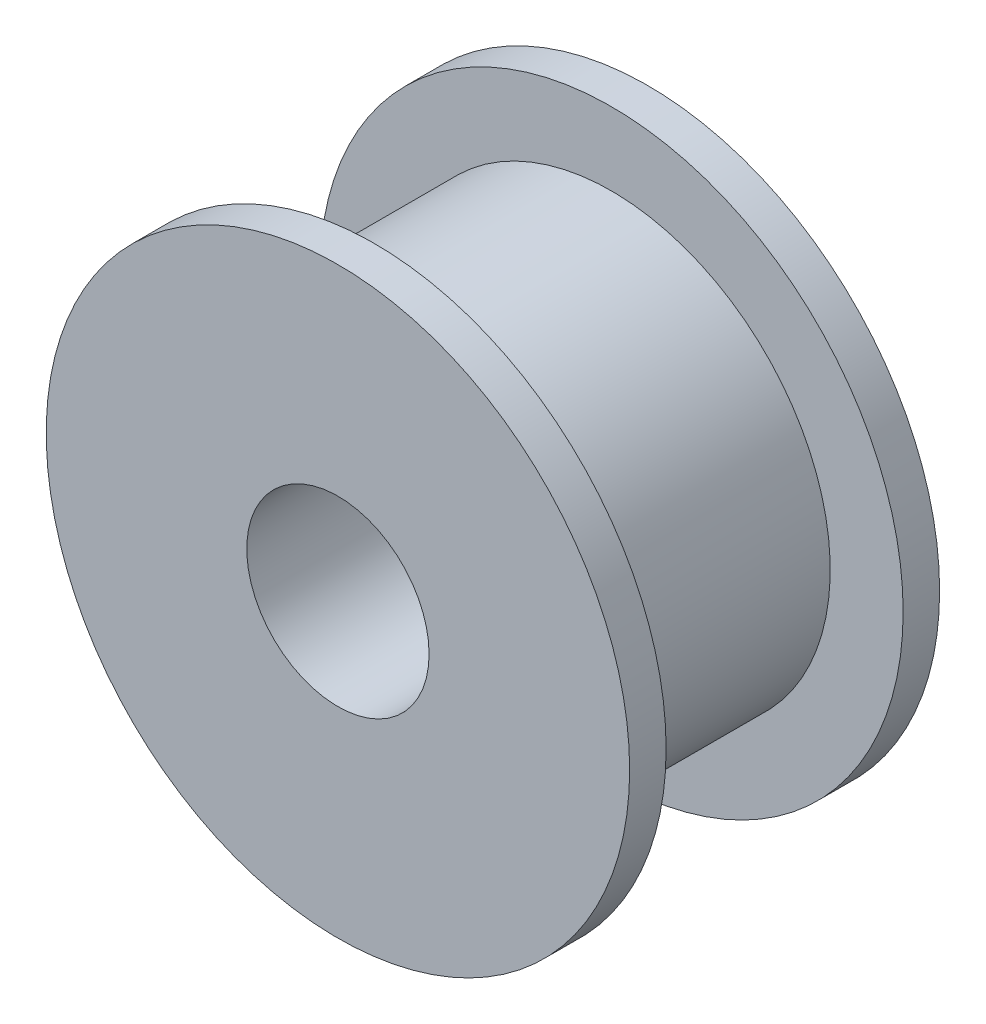
from build123d import *

# Parameters (mm, degrees)
SKETCH_1_R      = 8
SKETCH_1_R_2    = 2.5
EXTRUDE_1_DEPTH = 1
SKETCH_2_R      = 6
SKETCH_2_R_2    = 2.5
EXTRUDE_2_DEPTH = 6.5
SKETCH_3_R      = 8
SKETCH_3_R_2    = 6
EXTRUDE_3_DEPTH = 1
SKETCH_4_R      = 6
SKETCH_4_R_2    = 2.5
EXTRUDE_4_DEPTH = 1


with BuildPart() as part:
    # 草图1 → 凸台-拉伸1 (new body)
    with BuildSketch(Plane.XY):
        Circle(SKETCH_1_R)
        Circle(SKETCH_1_R_2, mode=Mode.SUBTRACT)
    extrude(amount=EXTRUDE_1_DEPTH)

    # 草图2 → 凸台-拉伸2 (add)
    with BuildSketch(Plane.XY.offset(1)):
        with Locations(Location((0, 0, 0), (0, 0, 180))):
            Circle(SKETCH_2_R)
        Circle(SKETCH_2_R_2, mode=Mode.SUBTRACT)
    extrude(amount=EXTRUDE_2_DEPTH)



with BuildPart() as body_2:
    # 草图3 → 凸台-拉伸3 (new body)
    with BuildSketch(Plane.XY.offset(7.5)):
        Circle(SKETCH_3_R)
        with Locations(Location((0, 0, 0), (0, 0, 180))):
            Circle(SKETCH_3_R_2, mode=Mode.SUBTRACT)
    extrude(amount=EXTRUDE_3_DEPTH)


with BuildPart() as part_1:
    add(part.part)

    add(body_2.part)  # 凸台-拉伸4 merges body 2
    # 草图4 → 凸台-拉伸4 (add)
    with BuildSketch(Plane.XY.offset(7.5)):
        with Locations(Location((0, 0, 0), (0, 0, 180))):
            Circle(SKETCH_4_R)
        Circle(SKETCH_4_R_2, mode=Mode.SUBTRACT)
    extrude(amount=EXTRUDE_4_DEPTH)


solid = part_1.part
